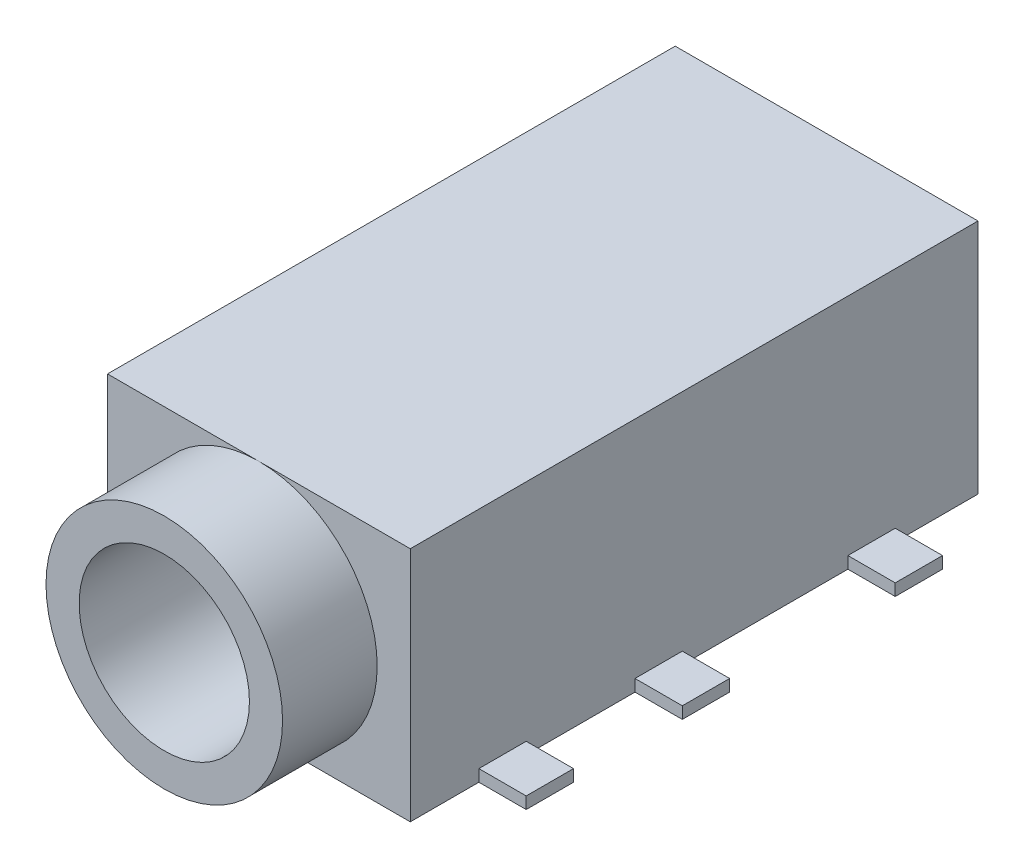
from build123d import *

# Parameters (mm, degrees)
SKETCH_1_W          = 6.4
SKETCH_1_H          = 12
EXTRUDE_1_DEPTH     = 5
SKETCH_2_R          = 2.5
EXTRUDE_2_DEPTH     = 2
SKETCH_3_R          = 0.8
EXTRUDE_3_DEPTH     = 0.5
SKETCH_4_W          = 1
SKETCH_4_H          = 0.25
EXTRUDE_4_DEPTH     = 1
SKETCH_5_R          = 1.8
CUT_EXTRUDE_1_DEPTH = 16.447977214
SKETCH_6_W          = 1
SKETCH_6_H          = 0.25
EXTRUDE_5_DEPTH     = 1


with BuildPart() as part:
    # 草图1 → 凸台-拉伸1 (new body)
    with BuildSketch(Plane(origin=(0, 0, 0), x_dir=(1, 0, 0), z_dir=(0, 1, 0))):
        with Locations((0, 6)):
            Rectangle(SKETCH_1_W, SKETCH_1_H)
    extrude(amount=EXTRUDE_1_DEPTH)

    # 草图2 → 凸台-拉伸2 (add)
    with BuildSketch(Plane.XY):
        with Locations(Location((0, 2.5, 0), (0, 0, 270))):
            Circle(SKETCH_2_R)
    extrude(amount=EXTRUDE_2_DEPTH)

    # 草图3 → 凸台-拉伸3 (add)
    with BuildSketch(Plane.XZ):
        with Locations(Location((0, -3, 0), (0, 0, 270))):
            Circle(SKETCH_3_R)
        with Locations(Location((0, -9, 0), (0, 0, 270))):
            Circle(SKETCH_3_R)
    extrude(amount=EXTRUDE_3_DEPTH)

    # 草图4 → 凸台-拉伸4 (add)
    with BuildSketch(Plane(origin=(3.2, 0, 0), x_dir=(0, 0, -1), z_dir=(1, 0, 0))):
        with Locations((1.95, 0.125)):
            Rectangle(SKETCH_4_W, SKETCH_4_H)
        with Locations((5.25, 0.125)):
            Rectangle(SKETCH_4_W, SKETCH_4_H)
        with Locations((9.75, 0.125)):
            Rectangle(SKETCH_4_W, SKETCH_4_H)
    extrude(amount=EXTRUDE_4_DEPTH)

    # 草图5 → 切除-拉伸1 (cut, through all)
    with BuildSketch(Plane.XY.offset(2)):
        with Locations((0, 2.5)):
            Circle(SKETCH_5_R)
    extrude(amount=-CUT_EXTRUDE_1_DEPTH, mode=Mode.SUBTRACT)

    # 草图6 → 凸台-拉伸5 (add)
    with BuildSketch(Plane.ZY.offset(3.2)):
        with Locations((-2.5, 0.125)):
            Rectangle(SKETCH_6_W, SKETCH_6_H)
        with Locations((-7.5, 0.125)):
            Rectangle(SKETCH_6_W, SKETCH_6_H)
    extrude(amount=EXTRUDE_5_DEPTH)


solid = part.part
